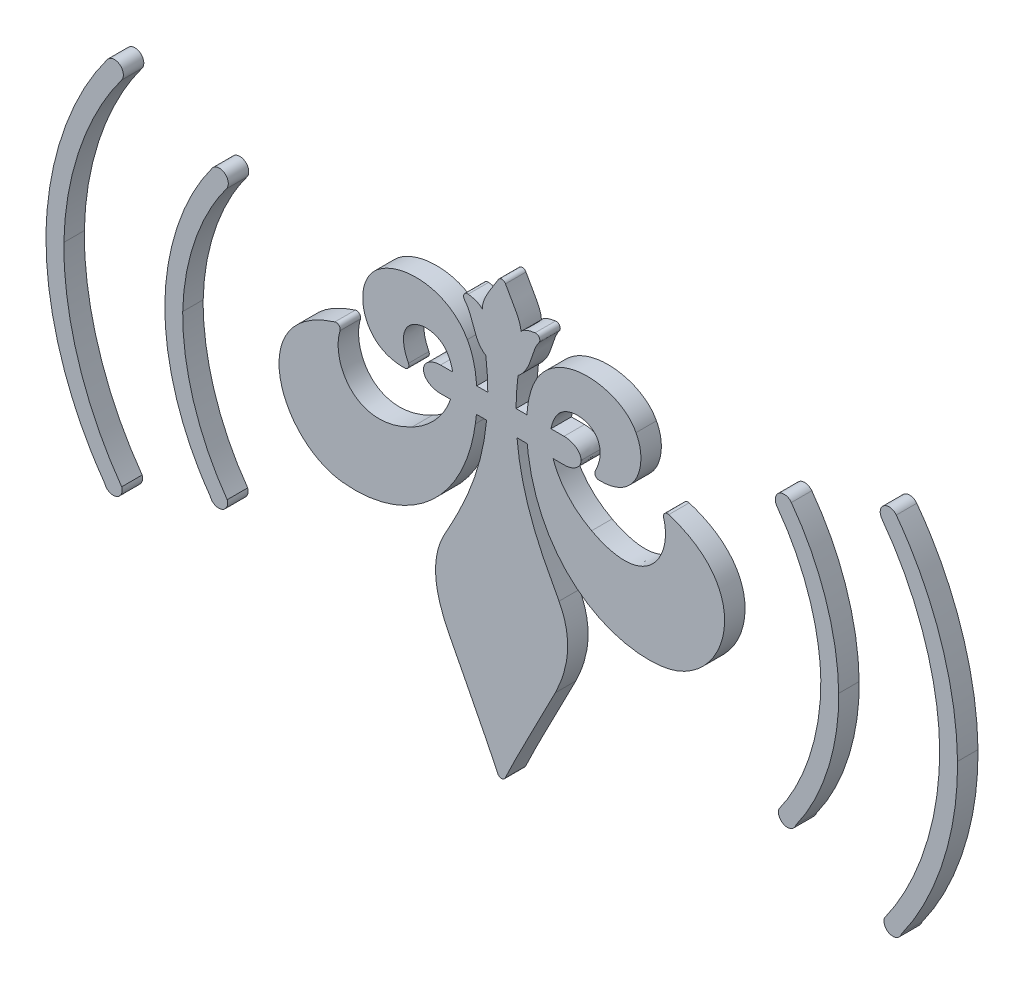
from build123d import *

# Parameters (mm, degrees)
BOSS_EXTRUDE1_DEPTH   = 2.54
BOSS_EXTRUDE1_2_DEPTH = 2.54
BOSS_EXTRUDE1_3_DEPTH = 2.54
BOSS_EXTRUDE1_4_DEPTH = 2.54
BOSS_EXTRUDE1_5_DEPTH = 2.54
FILLET2_R             = 0.508
FILLET3_R             = 0.508
FILLET4_R             = 0.508
FILLET5_R             = 0.508
FILLET6_R             = 0.508
FILLET7_R             = 0.508
FILLET8_R             = 0.508
FILLET9_R             = 0.508


with BuildPart() as part:
    # Model → Boss-Extrude1 (new body)
    with BuildSketch(Plane.XY):
        with BuildLine():
            Line((-91.014242563, 254.405126972), (-92.385226517, 254.405126972))
            add(Edge.make_bspline(
                [(-92.385226517, 254.405126972), (-92.498564771, 256.020587688), (-92.849471267, 257.56569536), (-93.548486537, 258.799330582)],
                knots=[0, 0, 0, 0, 1, 1, 1, 1], degree=3))
            add(Edge.make_bspline(
                [(-93.548486537, 258.799330582), (-96.463320654, 263.942858613), (-104.165895526, 262.862444436), (-105.929314241, 259.257852466)],
                knots=[0, 0, 0, 0, 1, 1, 1, 1], degree=3))
            add(Edge.make_bspline(
                [(-105.929314241, 259.257852466), (-107.533849984, 256.430606472), (-106.058181244, 251.191601292), (-100.505216133, 251.922482904)],
                knots=[0, 0, 0, 0, 1, 1, 1, 1], degree=3))
            add(Edge.make_bspline(
                [(-100.505216133, 251.922482904), (-103.790806731, 257.42389789), (-97.904031705, 258.799330582), (-96.146313697, 256.27774553)],
                knots=[0, 0, 0, 0, 1, 1, 1, 1], degree=3))
            add(Edge.make_bspline(
                [(-96.146313697, 256.27774553), (-95.749352801, 255.70833963), (-95.4947323, 255.07459718), (-95.371216981, 254.405126972)],
                knots=[0, 0, 0, 0, 1, 1, 1, 1], degree=3))
            Line((-95.371216981, 254.405126972), (-96.882768596, 254.405126972))
            add(Edge.make_bspline(
                [(-96.882768596, 254.405126972), (-98.054161404, 254.405126974), (-99.003841582, 253.717020055), (-99.003841582, 252.868041288)],
                knots=[0, 0, 0, 0, 1, 1, 1, 1], degree=3))
            add(Edge.make_bspline(
                [(-99.003841582, 252.868041288), (-99.003841582, 252.019029281), (-98.054161404, 251.330938982), (-96.882768596, 251.330938981)],
                knots=[0, 0, 0, 0, 1, 1, 1, 1], degree=3))
            Line((-96.882768596, 251.330938981), (-95.640967346, 251.330938981))
            add(Edge.make_bspline(
                [(-95.640967346, 251.330938981), (-96.335533959, 249.254923188), (-98.014599937, 247.230053096), (-100.425151392, 245.962579275)],
                knots=[0, 0, 0, 0, 1, 1, 1, 1], degree=3))
            add(Edge.make_bspline(
                [(-100.425151392, 245.962579275), (-107.837350308, 242.065561531), (-111.046388554, 248.942531089), (-108.983347547, 252.763018641)],
                knots=[0, 0, 0, 0, 1, 1, 1, 1], degree=3))
            add(Edge.make_bspline(
                [(-108.983347547, 252.763018641), (-121.667293313, 249.630172645), (-117.264020651, 236.663629147), (-109.059805718, 235.723655129)],
                knots=[0, 0, 0, 0, 1, 1, 1, 1], degree=3))
            add(Edge.make_bspline(
                [(-109.059805718, 235.723655129), (-101.724452776, 234.883108311), (-94.007257723, 240.002487283), (-92.55532254, 250.24144467)],
                knots=[0, 0, 0, 0, 1, 1, 1, 1], degree=3))
            add(Edge.make_bspline(
                [(-92.55532254, 250.24144467), (-92.504664361, 250.598334415), (-92.461823188, 250.962636742), (-92.428366852, 251.330938981)],
                knots=[0, 0, 0, 0, 1, 1, 1, 1], degree=3))
            Line((-92.428366852, 251.330938981), (-91.158366852, 251.330938981))
            add(Edge.make_bspline(
                [(-91.158366852, 251.330938981), (-91.829072488, 244.417925886), (-94.718666157, 239.545832395), (-96.428207927, 236.362760343)],
                knots=[0, 0, 0, 0, 1, 1, 1, 1], degree=3))
            add(Edge.make_bspline(
                [(-96.428207927, 236.362760343), (-98.659250821, 232.208617997), (-96.848531196, 228.116236081), (-95.966611317, 226.285034908)],
                knots=[0, 0, 0, 0, 1, 1, 1, 1], degree=3))
            add(Edge.make_bspline(
                [(-95.966611317, 226.285034908), (-94.966405922, 224.207955425), (-90.469212865, 215.812365152), (-89.315376462, 212.966061401)],
                knots=[0, 0, 0, 0, 1, 1, 1, 1], degree=3))
            add(Edge.make_bspline(
                [(-89.315376462, 212.966061401), (-88.161484658, 215.812365152), (-83.630403141, 224.207955425), (-82.630236526, 226.285034908)],
                knots=[0, 0, 0, 0, 1, 1, 1, 1], degree=3))
            add(Edge.make_bspline(
                [(-82.630236526, 226.285034908), (-81.74856595, 228.116236081), (-79.937735524, 232.208617997), (-82.168778418, 236.362760343)],
                knots=[0, 0, 0, 0, 1, 1, 1, 1], degree=3))
            add(Edge.make_bspline(
                [(-82.168778418, 236.362760343), (-83.889871183, 239.567671255), (-86.764645229, 244.386519367), (-87.389180123, 251.330938981)],
                knots=[0, 0, 0, 0, 1, 1, 1, 1], degree=3))
            Line((-87.389180123, 251.330938981), (-86.119180124, 251.330938981))
            add(Edge.make_bspline(
                [(-86.119180124, 251.330938981), (-86.085408004, 250.962791863), (-86.042877073, 250.598334415), (-85.992218895, 250.24144467)],
                knots=[0, 0, 0, 0, 1, 1, 1, 1], degree=3))
            add(Edge.make_bspline(
                [(-85.992218895, 250.24144467), (-84.540422213, 240.002659025), (-76.8232327, 234.883108311), (-69.487863138, 235.723655129)],
                knots=[0, 0, 0, 0, 1, 1, 1, 1], degree=3))
            add(Edge.make_bspline(
                [(-69.487863138, 235.723655129), (-61.283598345, 236.663800888), (-56.880170562, 249.630327766), (-69.564631552, 252.763018641)],
                knots=[0, 0, 0, 0, 1, 1, 1, 1], degree=3))
            add(Edge.make_bspline(
                [(-69.564631552, 252.763018641), (-67.501562844, 248.942531089), (-70.71065095, 242.065561531), (-78.122800006, 245.962579275)],
                knots=[0, 0, 0, 0, 1, 1, 1, 1], degree=3))
            add(Edge.make_bspline(
                [(-78.122800006, 245.962579275), (-80.533395781, 247.230053096), (-82.212290018, 249.254923188), (-82.907028372, 251.330938981)],
                knots=[0, 0, 0, 0, 1, 1, 1, 1], degree=3))
            Line((-82.907028372, 251.330938981), (-81.548841842, 251.330938981))
            add(Edge.make_bspline(
                [(-81.548841842, 251.330938981), (-80.377415794, 251.330938982), (-79.427718996, 252.01887416), (-79.427718996, 252.868041288)],
                knots=[0, 0, 0, 0, 1, 1, 1, 1], degree=3))
            add(Edge.make_bspline(
                [(-79.427718996, 252.868041288), (-79.427718996, 253.716876014), (-80.377415794, 254.405126974), (-81.548841842, 254.405126972)],
                knots=[0, 0, 0, 0, 1, 1, 1, 1], degree=3))
            Line((-81.548841842, 254.405126972), (-83.176612536, 254.405126972))
            add(Edge.make_bspline(
                [(-83.176612536, 254.405126972), (-83.052980877, 255.07459718), (-82.798471176, 255.70833963), (-82.401698641, 256.27774553)],
                knots=[0, 0, 0, 0, 1, 1, 1, 1], degree=3))
            add(Edge.make_bspline(
                [(-82.401698641, 256.27774553), (-80.643936314, 258.799330582), (-74.757000626, 257.42389789), (-78.042746345, 251.922482904)],
                knots=[0, 0, 0, 0, 1, 1, 1, 1], degree=3))
            add(Edge.make_bspline(
                [(-78.042746345, 251.922482904), (-72.489659353, 251.191601292), (-71.013957374, 256.430778213), (-72.618648238, 259.257852466)],
                knots=[0, 0, 0, 0, 1, 1, 1, 1], degree=3))
            add(Edge.make_bspline(
                [(-72.618648238, 259.257852466), (-74.382083572, 262.862444436), (-82.084658445, 263.942731192), (-84.999492562, 258.799330582)],
                knots=[0, 0, 0, 0, 1, 1, 1, 1], degree=3))
            add(Edge.make_bspline(
                [(-84.999492562, 258.799330582), (-85.69835271, 257.56569536), (-86.049364467, 256.020587688), (-86.162719343, 254.405126972)],
                knots=[0, 0, 0, 0, 1, 1, 1, 1], degree=3))
            Line((-86.162719343, 254.405126972), (-87.510025142, 254.405126972))
            add(Edge.make_bspline(
                [(-87.510025142, 254.405126972), (-87.497548958, 255.574547526), (-87.421700192, 256.79508054), (-87.265349022, 258.071950278)],
                knots=[0, 0, 0, 0, 1, 1, 1, 1], degree=3))
            add(Edge.make_bspline(
                [(-87.265349022, 258.071950278), (-85.05386803, 259.887262601), (-85.945189366, 262.428708716), (-83.683831342, 263.816008186)],
                knots=[0, 0, 0, 0, 1, 1, 1, 1], degree=3))
            add(Edge.make_bspline(
                [(-83.683831342, 263.816008186), (-85.23325471, 263.856816163), (-86.497188442, 263.553038836), (-86.904908107, 262.982242385)],
                knots=[0, 0, 0, 0, 1, 1, 1, 1], degree=3))
            add(Edge.make_bspline(
                [(-86.904908107, 262.982242385), (-86.904908107, 264.331642402), (-88.349779732, 266.021483769), (-89.246491533, 268.041445381)],
                knots=[0, 0, 0, 0, 1, 1, 1, 1], degree=3))
            add(Edge.make_bspline(
                [(-89.246491533, 268.041445381), (-90.21174478, 266.032741142), (-91.692482661, 264.637436306), (-91.692482661, 262.982242385)],
                knots=[0, 0, 0, 0, 1, 1, 1, 1], degree=3))
            add(Edge.make_bspline(
                [(-91.692482661, 262.982242385), (-92.100340827, 263.553038836), (-93.364341039, 263.856816163), (-94.913576046, 263.816008186)],
                knots=[0, 0, 0, 0, 1, 1, 1, 1], degree=3))
            add(Edge.make_bspline(
                [(-94.913576046, 263.816008186), (-92.447275111, 262.197932572), (-93.206333395, 259.491254592), (-91.259057184, 258.237010401)],
                knots=[0, 0, 0, 0, 1, 1, 1, 1], degree=3))
            add(Edge.make_bspline(
                [(-91.259057184, 258.237010401), (-91.095858517, 256.903150212), (-91.022059568, 255.626441134), (-91.014242563, 254.405126972)],
                knots=[0, 0, 0, 0, 1, 1, 1, 1], degree=3))
        make_face()
    extrude(amount=BOSS_EXTRUDE1_DEPTH)

    # Fillet2
    fillet2_edges = [part.edges().sort_by_distance(p)[0] for p in [
        (-89.315376462, 212.966061401, 1.27),
    ]]
    fillet(fillet2_edges, radius=FILLET2_R)

    # Fillet3
    fillet3_edges = [part.edges().sort_by_distance(p)[0] for p in [
        (-89.246491533, 268.041445381, 1.27),
    ]]
    fillet(fillet3_edges, radius=FILLET3_R)

    # Fillet4
    fillet4_edges = [part.edges().sort_by_distance(p)[0] for p in [
        (-94.913576046, 263.816008186, 1.27),
    ]]
    fillet(fillet4_edges, radius=FILLET4_R)

    # Fillet5
    fillet5_edges = [part.edges().sort_by_distance(p)[0] for p in [
        (-83.683831342, 263.816008186, 1.27),
    ]]
    fillet(fillet5_edges, radius=FILLET5_R)

    # Fillet6
    fillet6_edges = [part.edges().sort_by_distance(p)[0] for p in [
        (-78.042746345, 251.922482904, 1.27),
    ]]
    fillet(fillet6_edges, radius=FILLET6_R)

    # Fillet7
    fillet7_edges = [part.edges().sort_by_distance(p)[0] for p in [
        (-100.505216133, 251.922482904, 1.27),
    ]]
    fillet(fillet7_edges, radius=FILLET7_R)

    # Fillet8
    fillet8_edges = [part.edges().sort_by_distance(p)[0] for p in [
        (-69.564631552, 252.763018641, 1.27),
    ]]
    fillet(fillet8_edges, radius=FILLET8_R)

    # Fillet9
    fillet9_edges = [part.edges().sort_by_distance(p)[0] for p in [
        (-108.983347547, 252.763018641, 1.27),
    ]]
    fillet(fillet9_edges, radius=FILLET9_R)


with BuildPart() as body_2:
    # Model → Boss-Extrude1 2 (new body)
    with BuildSketch(Plane.XY):
        with BuildLine():
            ThreePointArc((-53.325152431, 261.393431878), (-54.875374641, 261.621860486), (-55.103803249, 260.071638276))
            add(Edge.make_bspline(
                [(-55.103803249, 260.071638276), (-51.757285621, 255.568449347), (-49.772827635, 249.752266486), (-49.665767325, 244.142771959)],
                knots=[0, 0, 0, 0, 0.989781357, 0.989781357, 0.989781357, 0.989781357], degree=3))
            add(Edge.make_bspline(
                [(-49.665767325, 244.142771959), (-49.593820503, 238.380767506), (-51.506581459, 232.332868748), (-54.878701228, 227.660109398)],
                knots=[0, 0, 0, 0, 1, 1, 1, 1], degree=3))
            ThreePointArc((-54.878701228, 227.660109398), (-54.156383777, 226.269560574), (-52.765834953, 226.991878025))
            add(Edge.make_bspline(
                [(-52.765834953, 226.991878025), (-49.323860927, 231.761434306), (-47.371477184, 237.93461652), (-47.444914173, 243.815981949)],
                knots=[0, 0, 0, 0, 1, 1, 1, 1], degree=3))
            add(Edge.make_bspline(
                [(-47.444914173, 243.815981949), (-47.522045807, 249.993813323), (-49.639959737, 256.434510162), (-53.325152431, 261.393431878)],
                knots=[0, 0, 0, 0, 1.009909674, 1.009909674, 1.009909674, 1.009909674], degree=3))
        make_face()
    extrude(amount=BOSS_EXTRUDE1_2_DEPTH)


with BuildPart() as body_3:
    # Model → Boss-Extrude1 3 (new body)
    with BuildSketch(Plane.XY):
        with BuildLine():
            ThreePointArc((-40.295163737, 266.559767478), (-41.845385742, 266.788197478), (-42.073815741, 265.237975472))
            add(Edge.make_bspline(
                [(-42.073815741, 265.237975472), (-37.655709631, 259.292809172), (-35.040189598, 251.60895755), (-34.910520595, 244.203024124)],
                knots=[0, 0, 0, 0, 0.992225282, 0.992225282, 0.992225282, 0.992225282], degree=3))
            add(Edge.make_bspline(
                [(-34.910520595, 244.203024124), (-34.815768369, 236.614054643), (-37.335002649, 228.648540624), (-41.776327199, 222.494186715)],
                knots=[0, 0, 0, 0, 1, 1, 1, 1], degree=3))
            ThreePointArc((-41.776327199, 222.494186715), (-41.054009886, 221.10363782), (-39.663460991, 221.825955133))
            add(Edge.make_bspline(
                [(-39.663460991, 221.825955133), (-35.152368077, 228.076987302), (-32.593559277, 236.167630896), (-32.6898, 243.875814869)],
                knots=[0, 0, 0, 0, 1, 1, 1, 1], degree=3))
            add(Edge.make_bspline(
                [(-32.6898, 243.875814869), (-32.789368831, 251.850176829), (-35.538312428, 260.158773162), (-40.295163737, 266.559767478)],
                knots=[0, 0, 0, 0, 1.007594664, 1.007594664, 1.007594664, 1.007594664], degree=3))
        make_face()
    extrude(amount=BOSS_EXTRUDE1_3_DEPTH)


with BuildPart() as body_4:
    # Model → Boss-Extrude1 4 (new body)
    with BuildSketch(Plane.XY):
        with BuildLine():
            ThreePointArc((-136.485301257, 265.237975472), (-136.713731257, 266.788197478), (-138.263953262, 266.559767478))
            add(Edge.make_bspline(
                [(-138.263953262, 266.559767478), (-143.020804572, 260.158773162), (-145.769748168, 251.850176829), (-145.869316999, 243.875814869)],
                knots=[0, 0, 0, 0, 1.007594664, 1.007594664, 1.007594664, 1.007594664], degree=3))
            add(Edge.make_bspline(
                [(-145.869316999, 243.875814869), (-145.969850096, 235.823842889), (-143.296917427, 227.372353439), (-138.584628012, 220.8425228)],
                knots=[0, 0, 0, 0, 1, 1, 1, 1], degree=3))
            ThreePointArc((-138.584628012, 220.8425228), (-137.194079116, 220.120205487), (-136.471761803, 221.510754382))
            add(Edge.make_bspline(
                [(-136.471761803, 221.510754382), (-141.114282856, 227.94390676), (-143.747641002, 236.270266636), (-143.648596405, 244.203024124)],
                knots=[0, 0, 0, 0, 1, 1, 1, 1], degree=3))
            add(Edge.make_bspline(
                [(-143.648596405, 244.203024124), (-143.518927401, 251.60895755), (-140.903407368, 259.292809172), (-136.485301257, 265.237975472)],
                knots=[0, 0, 0, 0, 0.992225282, 0.992225282, 0.992225282, 0.992225282], degree=3))
        make_face()
    extrude(amount=BOSS_EXTRUDE1_4_DEPTH)


with BuildPart() as body_5:
    # Model → Boss-Extrude1 5 (new body)
    with BuildSketch(Plane.XY):
        with BuildLine():
            ThreePointArc((-123.45531424, 260.071637616), (-123.683741698, 261.621859995), (-125.233964077, 261.393432538))
            add(Edge.make_bspline(
                [(-125.233964077, 261.393432538), (-128.919160607, 256.434513348), (-131.037071189, 249.993813584), (-131.114202826, 243.815981949)],
                knots=[0, 0, 0, 0, 1.009909674, 1.009909674, 1.009909674, 1.009909674], degree=3))
            add(Edge.make_bspline(
                [(-131.114202826, 243.815981949), (-131.191930658, 237.590974723), (-129.125471254, 231.057100175), (-125.482386421, 226.0088639)],
                knots=[0, 0, 0, 0, 1, 1, 1, 1], degree=3))
            ThreePointArc((-125.482386421, 226.0088639), (-124.091837597, 225.286546449), (-123.369520147, 226.677095273))
            add(Edge.make_bspline(
                [(-123.369520147, 226.677095273), (-126.942750712, 231.628534626), (-128.969587355, 238.037125713), (-128.893349676, 244.142771964)],
                knots=[0, 0, 0, 0, 1, 1, 1, 1], degree=3))
            add(Edge.make_bspline(
                [(-128.893349676, 244.142771964), (-128.786289479, 249.752266231), (-126.801835054, 255.568451382), (-123.45531424, 260.071637616)],
                knots=[0, 0, 0, 0, 0.989781358, 0.989781358, 0.989781358, 0.989781358], degree=3))
        make_face()
    extrude(amount=BOSS_EXTRUDE1_5_DEPTH)


solid = Compound([part.part, body_2.part, body_3.part, body_4.part, body_5.part])
